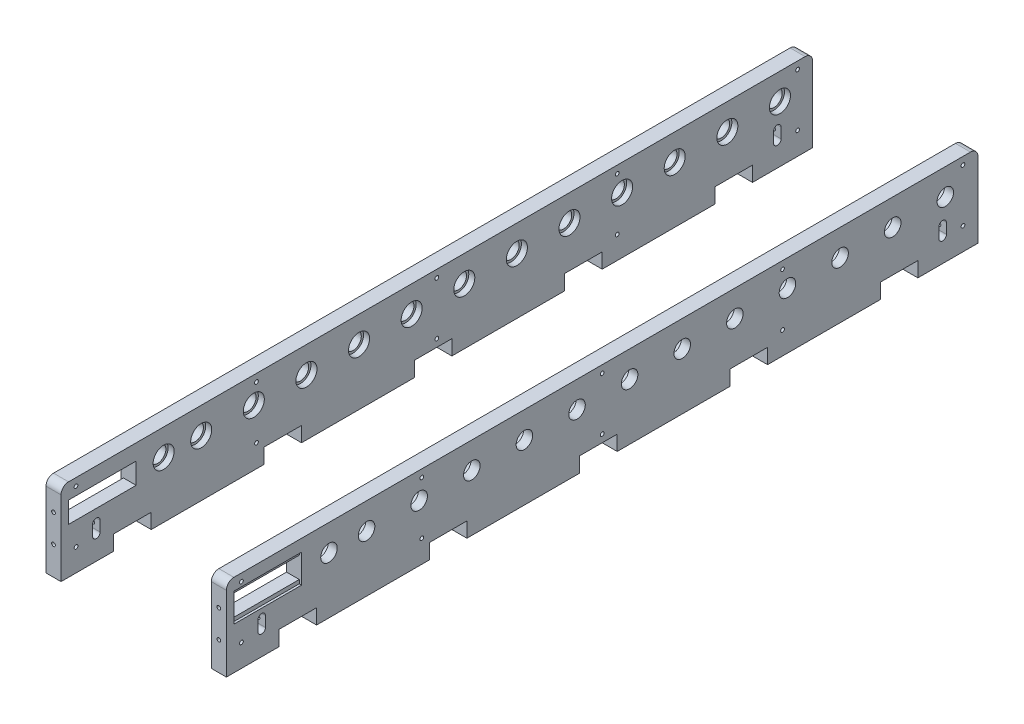
from build123d import *

# Parameters (mm, degrees)
SKETCH1_W                 = 1000
SKETCH1_H                 = 100
SKETCH1_R                 = 11
SKETCH1_W_2               = 90
SKETCH1_H_2               = 28
BOSS_EXTRUDE1_DEPTH       = 20
SKETCH2_W                 = 20
SKETCH2_H                 = 50
SKETCH2_R                 = 4
CUT_EXTRUDE2_DEPTH        = 20
LPATTERN1_COUNT           = 2
LPATTERN1_PITCH           = 220
SKETCH12_R                = 14
CUT_EXTRUDE6_DEPTH        = 8
SKETCH14_W                = 2.5
SKETCH14_H                = 10
SKETCH16_W                = 90
SKETCH16_H                = 5
CUT_EXTRUDE7_DEPTH        = 3
SKETCH17_W                = 90
SKETCH17_H                = 5
CUT_EXTRUDE8_DEPTH        = 3
SKETCH18_R                = 14
CUT_EXTRUDE9_DEPTH        = 8
SKETCH20_W                = 20
SKETCH20_H                = 1000
BOSS_EXTRUDE2_DEPTH       = 10
FILLET1_R                 = 10
FILLET2_R                 = 10
F_5_0MM_DOWEL_HOLE3_D     = 5
F_5_0MM_DOWEL_HOLE3_DEPTH = 10
F_5_0MM_DOWEL_HOLE3_TIP   = 1.502151548
SKETCH27_R                = 2.5
CUT_EXTRUDE10_DEPTH       = 55
CUT_EXTRUDE11_DEPTH       = 1035.26302264
CUT_EXTRUDE12_START       = -70
SKETCH29_R                = 2.5
CUT_EXTRUDE12_DEPTH       = 70
SKETCH30_R                = 2.5
CUT_EXTRUDE13_DEPTH       = 1035.26302264
CUT_EXTRUDE14_REACH       = 1036.263
SKETCH31_W                = 1251.907534991
SKETCH31_H                = 393.114099754
SKETCH32_R                = 4
CUT_EXTRUDE15_DEPTH       = 35
SKETCH33_W                = 65.05227589
SKETCH33_H                = 375.52628901
BOSS_EXTRUDE3_DEPTH       = 30
SKETCH34_W                = 254.514053078
SKETCH34_H                = 718.093221187
SKETCH34_W_2              = 5.681117256
SKETCH34_H_2              = 142.027931406
SKETCH34_W_3              = 102.260110611
SKETCH34_H_3              = 870.347163652
CUT_EXTRUDE16_DEPTH       = 30
SKETCH35_W                = 51.212296783
SKETCH35_H                = 868.079155123
CUT_EXTRUDE17_DEPTH       = 30


with BuildPart() as part:
    # Sketch1 → Boss-Extrude1 (new body)
    with BuildSketch(Plane(origin=(0, 0, 0), x_dir=(0, 0, -1), z_dir=(1, 0, 0))):
        with Locations((500, 50)):
            Rectangle(SKETCH1_W, SKETCH1_H)
        with Locations((956.5, 75)):
            Circle(SKETCH1_R, mode=Mode.SUBTRACT)
        with Locations((886.5, 75)):
            Circle(SKETCH1_R, mode=Mode.SUBTRACT)
        with Locations((816.5, 75)):
            Circle(SKETCH1_R, mode=Mode.SUBTRACT)
        with Locations((746.5, 75)):
            Circle(SKETCH1_R, mode=Mode.SUBTRACT)
        with Locations((676.5, 75)):
            Circle(SKETCH1_R, mode=Mode.SUBTRACT)
        with Locations((606.5, 75)):
            Circle(SKETCH1_R, mode=Mode.SUBTRACT)
        with Locations((536.5, 75)):
            Circle(SKETCH1_R, mode=Mode.SUBTRACT)
        with Locations((466.5, 75)):
            Circle(SKETCH1_R, mode=Mode.SUBTRACT)
        with Locations((396.5, 75)):
            Circle(SKETCH1_R, mode=Mode.SUBTRACT)
        with Locations((326.5, 75)):
            Circle(SKETCH1_R, mode=Mode.SUBTRACT)
        with Locations((256.5, 75)):
            Circle(SKETCH1_R, mode=Mode.SUBTRACT)
        with Locations((186.5, 75)):
            Circle(SKETCH1_R, mode=Mode.SUBTRACT)
        with Locations((136.5, 75)):
            Circle(SKETCH1_R, mode=Mode.SUBTRACT)
        with Locations((55, 75)):
            Rectangle(SKETCH1_W_2, SKETCH1_H_2, mode=Mode.SUBTRACT)
    extrude(amount=BOSS_EXTRUDE1_DEPTH)

    # Sketch2 → Cut-Extrude2 (cut)
    # profile 1 of 5: a face of its own
    with BuildSketch(Plane.XZ):
        with Locations((10, -895)):
            Rectangle(SKETCH2_W, SKETCH2_H)
        with Locations(Location((10, -910, 0), (0, 0, 270))):
            Circle(SKETCH2_R, mode=Mode.SUBTRACT)
        with Locations(Location((10, -880, 0), (0, 0, 270))):
            Circle(SKETCH2_R, mode=Mode.SUBTRACT)
    # profile 2 of 5: a face of its own
    with BuildSketch(Plane.XZ):
        with Locations((10, -695)):
            Rectangle(SKETCH2_W, SKETCH2_H)
        with Locations(Location((10, -710, 0), (0, 0, 270))):
            Circle(SKETCH2_R, mode=Mode.SUBTRACT)
        with Locations(Location((10, -680, 0), (0, 0, 270))):
            Circle(SKETCH2_R, mode=Mode.SUBTRACT)
    # profile 3 of 5: a face of its own
    with BuildSketch(Plane.XZ):
        with Locations((10, -495)):
            Rectangle(SKETCH2_W, SKETCH2_H)
        with Locations(Location((10, -510, 0), (0, 0, 270))):
            Circle(SKETCH2_R, mode=Mode.SUBTRACT)
        with Locations(Location((10, -480, 0), (0, 0, 270))):
            Circle(SKETCH2_R, mode=Mode.SUBTRACT)
    # profile 4 of 5: a face of its own
    with BuildSketch(Plane.XZ):
        with Locations((10, -295)):
            Rectangle(SKETCH2_W, SKETCH2_H)
        with Locations(Location((10, -310, 0), (0, 0, 270))):
            Circle(SKETCH2_R, mode=Mode.SUBTRACT)
        with Locations(Location((10, -280, 0), (0, 0, 270))):
            Circle(SKETCH2_R, mode=Mode.SUBTRACT)
    # profile 5 of 5: a face of its own
    with BuildSketch(Plane.XZ):
        with Locations((10, -95)):
            Rectangle(SKETCH2_W, SKETCH2_H)
        with Locations(Location((10, -110, 0), (0, 0, 270))):
            Circle(SKETCH2_R, mode=Mode.SUBTRACT)
        with Locations(Location((10, -80, 0), (0, 0, 270))):
            Circle(SKETCH2_R, mode=Mode.SUBTRACT)
    extrude(amount=-CUT_EXTRUDE2_DEPTH, mode=Mode.SUBTRACT)


with BuildPart() as lpattern1_1:
    # LPattern1: pattern copy
    add(part.part.moved(Location(Vector(-1, 0, 0) * (1 * LPATTERN1_PITCH))))

    # Sketch12 → Cut-Extrude6 (cut)
    with BuildSketch(Plane(origin=(-200, 0, 0), x_dir=(0, 0, -1), z_dir=(1, 0, 0))):
        with Locations((956.5, 75)):
            Circle(SKETCH12_R)
        with Locations((886.5, 75)):
            Circle(SKETCH12_R)
        with Locations((816.5, 75)):
            Circle(SKETCH12_R)
        with Locations((746.5, 75)):
            Circle(SKETCH12_R)
        with Locations((676.5, 75)):
            Circle(SKETCH12_R)
        with Locations((606.5, 75)):
            Circle(SKETCH12_R)
        with Locations((536.5, 75)):
            Circle(SKETCH12_R)
        with Locations((466.5, 75)):
            Circle(SKETCH12_R)
        with Locations((396.5, 75)):
            Circle(SKETCH12_R)
        with Locations((326.5, 75)):
            Circle(SKETCH12_R)
        with Locations((256.5, 75)):
            Circle(SKETCH12_R)
        with Locations((186.5, 75)):
            Circle(SKETCH12_R)
        with Locations((136.5, 75)):
            Circle(SKETCH12_R)
    extrude(amount=-CUT_EXTRUDE6_DEPTH, mode=Mode.SUBTRACT)

    # Sketch16 → Cut-Extrude7 (cut)
    with BuildSketch(Plane.ZY.offset(220)):
        with Locations((-55, 91.5)):
            Rectangle(SKETCH16_W, SKETCH16_H)
        with Locations((-55, 58.5)):
            Rectangle(SKETCH16_W, SKETCH16_H)
    extrude(amount=-CUT_EXTRUDE7_DEPTH, mode=Mode.SUBTRACT)


with BuildPart() as part_1:
    add(part.part)

    # Sketch14 → Ø5.0mm Dowel Hole1 (revolve, cut)
    with BuildSketch(Plane(origin=(10, 75, 0), x_dir=(0, -1, 0), z_dir=(1, 0, 0))):
        with Locations((1.25, 5)):
            Rectangle(SKETCH14_W, SKETCH14_H)
    revolve(axis=Axis((10, 75, 6.35), (0, 0, -1)), mode=Mode.SUBTRACT)

    # Sketch17 → Cut-Extrude8 (cut)
    with BuildSketch(Plane(origin=(20, 0, 0), x_dir=(0, 0, -1), z_dir=(1, 0, 0))):
        with Locations((55, 91.5)):
            Rectangle(SKETCH17_W, SKETCH17_H)
        with Locations((55, 58.5)):
            Rectangle(SKETCH17_W, SKETCH17_H)
    extrude(amount=-CUT_EXTRUDE8_DEPTH, mode=Mode.SUBTRACT)

    # Sketch18 → Cut-Extrude9 (cut)
    with BuildSketch(Plane.ZY):
        with Locations((-956.5, 75)):
            Circle(SKETCH18_R)
        with Locations((-886.5, 75)):
            Circle(SKETCH18_R)
        with Locations((-816.5, 75)):
            Circle(SKETCH18_R)
        with Locations((-746.5, 75)):
            Circle(SKETCH18_R)
        with Locations((-676.5, 75)):
            Circle(SKETCH18_R)
        with Locations((-606.5, 75)):
            Circle(SKETCH18_R)
        with Locations((-536.5, 75)):
            Circle(SKETCH18_R)
        with Locations((-466.5, 75)):
            Circle(SKETCH18_R)
        with Locations((-396.5, 75)):
            Circle(SKETCH18_R)
        with Locations((-326.5, 75)):
            Circle(SKETCH18_R)
        with Locations((-256.5, 75)):
            Circle(SKETCH18_R)
        with Locations((-186.5, 75)):
            Circle(SKETCH18_R)
        with Locations((-136.5, 75)):
            Circle(SKETCH18_R)
    extrude(amount=-CUT_EXTRUDE9_DEPTH, mode=Mode.SUBTRACT)

    add(lpattern1_1.part)  # Boss-Extrude2 merges LPattern1_1
    # Sketch20 → Boss-Extrude2 (add)
    with BuildSketch(Plane(origin=(0, 100, 0), x_dir=(1, 0, 0), z_dir=(0, 1, 0))):
        with Locations((-210, 500)):
            Rectangle(SKETCH20_W, SKETCH20_H)
        with Locations((10, 500)):
            Rectangle(SKETCH20_W, SKETCH20_H)
    extrude(amount=BOSS_EXTRUDE2_DEPTH)

    # Fillet1
    fillet1_edges = [part_1.edges().sort_by_distance(p)[0] for p in [
        (-210, 110, 0),
        (-210, 110, -1000),
    ]]
    fillet(fillet1_edges, radius=FILLET1_R)

    # Fillet2
    fillet2_edges = [part_1.edges().sort_by_distance(p)[0] for p in [
        (10, 110, 0),
        (10, 110, -1000),
    ]]
    fillet(fillet2_edges, radius=FILLET2_R)

    # Ø5.0mm Dowel Hole3
    with Locations(Plane(origin=(-210, 74.987891575, 0), x_dir=(1, 0, 0), z_dir=(0, 0, 1))):
        with Locations((0, 0)):
            Hole(F_5_0MM_DOWEL_HOLE3_D / 2, depth=F_5_0MM_DOWEL_HOLE3_DEPTH)
            with Locations((0, 0, -(F_5_0MM_DOWEL_HOLE3_DEPTH + F_5_0MM_DOWEL_HOLE3_TIP / 2))):  # 118° drill point
                Cone(0, F_5_0MM_DOWEL_HOLE3_D / 2, F_5_0MM_DOWEL_HOLE3_TIP, mode=Mode.SUBTRACT)

    # Sketch27 → Cut-Extrude10 (cut)
    with BuildSketch(Plane.XY):
        with Locations((-210, 38)):
            Circle(SKETCH27_R)
        with Locations((10, 38)):
            Circle(SKETCH27_R)
    extrude(amount=-CUT_EXTRUDE10_DEPTH, mode=Mode.SUBTRACT)

    # Sketch28 → Cut-Extrude11 (cut, through all)
    with BuildSketch(Plane.ZY.offset(220)):
        with BuildLine():
            Line((-42, 44.831263619), (-42, 31.168736381))
            ThreePointArc((-42, 31.168736381), (-47, 26.168736381), (-52, 31.168736381))
            Line((-52, 31.168736381), (-52, 44.831263619))
            ThreePointArc((-52, 44.831263619), (-47, 49.831263619), (-42, 44.831263619))
        make_face()
        with BuildLine():
            Line((-958, 44.831263619), (-958, 31.168736381))
            ThreePointArc((-958, 31.168736381), (-953, 26.168736381), (-948, 31.168736381))
            Line((-948, 31.168736381), (-948, 44.831263619))
            ThreePointArc((-948, 44.831263619), (-953, 49.831263619), (-958, 44.831263619))
        make_face()
    extrude(amount=-CUT_EXTRUDE11_DEPTH, mode=Mode.SUBTRACT)

    # Sketch29 → Cut-Extrude12 (cut)
    with BuildSketch(Plane(origin=(0, 0, -1000), x_dir=(-1, 0, 0), z_dir=(0, 0, -1)).offset(CUT_EXTRUDE12_START)):
        with Locations(Location((-10, 38, 0), (0, 0, 180))):
            Circle(SKETCH29_R)
        with Locations(Location((210, 38, 0), (0, 0, 180))):
            Circle(SKETCH29_R)
    extrude(amount=CUT_EXTRUDE12_DEPTH, mode=Mode.SUBTRACT)

    # Sketch30 → Cut-Extrude13 (cut, through all)
    with BuildSketch(Plane(origin=(20, 0, 0), x_dir=(0, 0, -1), z_dir=(1, 0, 0))):
        with Locations((500, 30)):
            Circle(SKETCH30_R)
        with Locations((20, 30)):
            Circle(SKETCH30_R)
        with Locations((20, 100)):
            Circle(SKETCH30_R)
        with Locations((500, 100)):
            Circle(SKETCH30_R)
        with Locations((980, 100)):
            Circle(SKETCH30_R)
        with Locations((980, 30)):
            Circle(SKETCH30_R)
        with Locations((260, 100)):
            Circle(SKETCH30_R)
        with Locations((740, 100)):
            Circle(SKETCH30_R)
        with Locations((740, 30)):
            Circle(SKETCH30_R)
        with Locations((260, 30)):
            Circle(SKETCH30_R)
    extrude(amount=-CUT_EXTRUDE13_DEPTH, mode=Mode.SUBTRACT)

    # Sketch31 → Cut-Extrude14 (cut, up to next)
    with BuildSketch(Plane.ZY.offset(220), mode=Mode.PRIVATE) as cut_extrude14_sk1:
        with Locations((-530.819455446, 0)):
            Rectangle(SKETCH31_W, SKETCH31_H)
    cut_extrude14_tool1 = extrude(cut_extrude14_sk1.sketch, amount=-CUT_EXTRUDE14_REACH, mode=Mode.PRIVATE) & part_1.part
    add(cut_extrude14_tool1.solids().sort_by_distance((-220, 0, -530.819455))[0], mode=Mode.SUBTRACT)

    # Sketch32 → Cut-Extrude15 (cut)
    with BuildSketch(Plane.XZ):
        with Locations(Location((10, -310, 0), (0, 0, 270))):
            Circle(SKETCH32_R)
        with Locations(Location((10, -280, 0), (0, 0, 270))):
            Circle(SKETCH32_R)
        with Locations(Location((10, -110, 0), (0, 0, 270))):
            Circle(SKETCH32_R)
        with Locations(Location((10, -80, 0), (0, 0, 270))):
            Circle(SKETCH32_R)
        with Locations(Location((10, -480, 0), (0, 0, 270))):
            Circle(SKETCH32_R)
        with Locations(Location((10, -510, 0), (0, 0, 270))):
            Circle(SKETCH32_R)
        with Locations(Location((10, -680, 0), (0, 0, 270))):
            Circle(SKETCH32_R)
        with Locations(Location((10, -710, 0), (0, 0, 270))):
            Circle(SKETCH32_R)
        with Locations(Location((10, -880, 0), (0, 0, 270))):
            Circle(SKETCH32_R)
        with Locations(Location((10, -910, 0), (0, 0, 270))):
            Circle(SKETCH32_R)
    extrude(amount=-CUT_EXTRUDE15_DEPTH, mode=Mode.SUBTRACT)


with BuildPart() as body_2:
    # Sketch33 → Boss-Extrude3 (new body)
    with BuildSketch(Plane(origin=(0, 0, -1000), x_dir=(-1, 0, 0), z_dir=(0, 0, -1))):
        with Locations((-100, 100)):
            Rectangle(SKETCH33_W, SKETCH33_H)
    extrude(amount=BOSS_EXTRUDE3_DEPTH)


with BuildPart() as body_3:
    # Mirror4: mirrored copy
    add(body_2.part.mirror(Plane(origin=(0, 0, 0), x_dir=(0, 0, 1), z_dir=(1, 0, 0))))


with BuildPart() as body_4:
    # Mirror5: mirrored copy
    add(part_1.part.mirror(Plane(origin=(-100, 0, 0), x_dir=(0, 0, 1), z_dir=(1, 0, 0))))


with BuildPart() as cut_extrude16_tool:
    # Sketch34 → Cut-Extrude16 (new body)
    # profile 1 of 2: a face of its own
    with BuildSketch(Plane(origin=(0, 0, -1030), x_dir=(-1, 0, 0), z_dir=(0, 0, -1))):
        with Locations((-179.181204632, 236.062758287)):
            Rectangle(SKETCH34_W, SKETCH34_H)
        with Locations((-182.02176326, 307.076723989)):
            Rectangle(SKETCH34_W_2, SKETCH34_H_2, mode=Mode.SUBTRACT)
    # profile 2 of 2: a face of its own
    with BuildSketch(Plane(origin=(0, 0, -1030), x_dir=(-1, 0, 0), z_dir=(0, 0, -1))):
        with Locations((126.462903753, 301.395606733)):
            Rectangle(SKETCH34_W_3, SKETCH34_H_3)
    extrude(amount=-CUT_EXTRUDE16_DEPTH)


with BuildPart() as body_2_1:
    add(body_2.part)

    # Cut-Extrude16: cut by cut_extrude16_tool
    add(cut_extrude16_tool.part, mode=Mode.SUBTRACT)


with BuildPart() as body_3_1:
    add(body_3.part)

    # Cut-Extrude16: cut by cut_extrude16_tool
    add(cut_extrude16_tool.part, mode=Mode.SUBTRACT)

    # Sketch35 → Cut-Extrude17 (cut)
    with BuildSketch(Plane(origin=(0, 0, -1030), x_dir=(-1, 0, 0), z_dir=(0, 0, -1))):
        with Locations((71.403355251, 287.763144505)):
            Rectangle(SKETCH35_W, SKETCH35_H)
    extrude(amount=-CUT_EXTRUDE17_DEPTH, mode=Mode.SUBTRACT)


solid = Compound([part_1.part, body_4.part])
